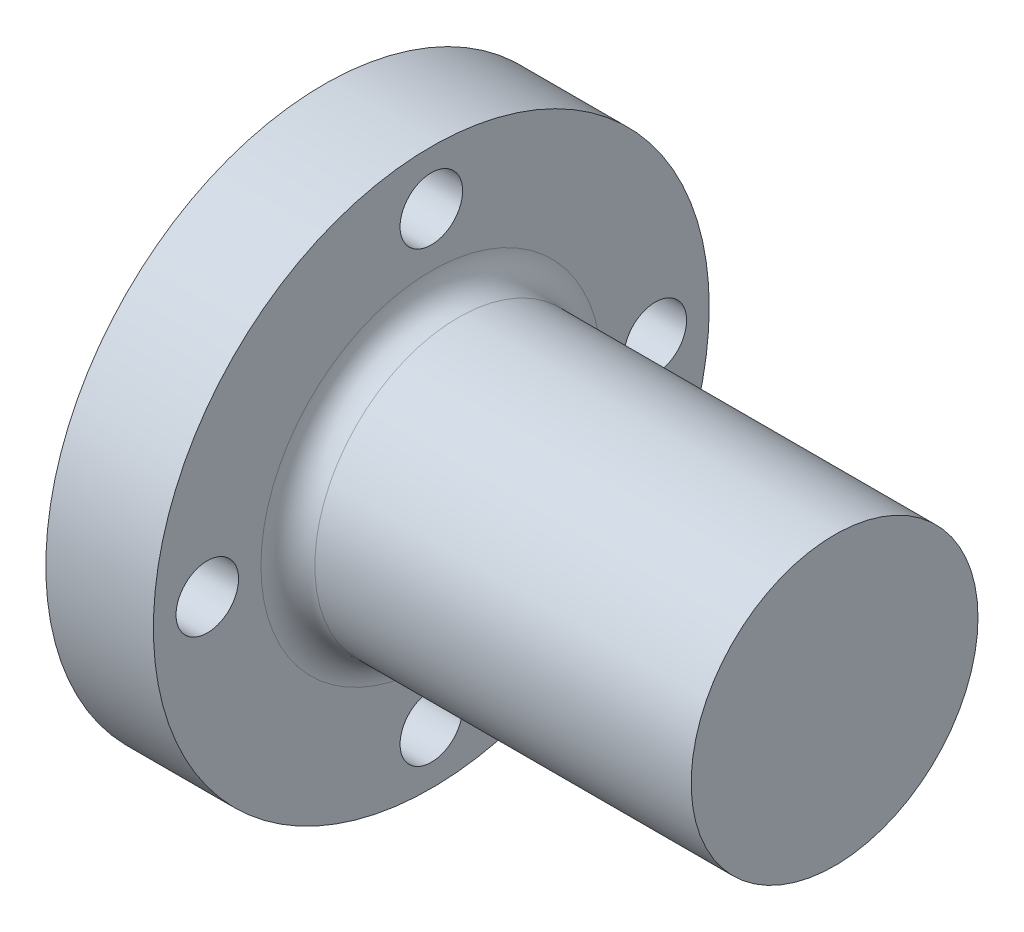
from build123d import *

# Parameters (mm, degrees)
SKETCH1_R           = 24.6126
BOSS_EXTRUDE1_DEPTH = 9.525
BOSS_EXTRUDE2_START = 9.525
SKETCH2_R           = 12.7
BOSS_EXTRUDE2_DEPTH = 35.7124
SKETCH3_R           = 8.7122
BOSS_EXTRUDE4_DEPTH = 4.826
SKETCH4_R           = 2.7686
CUT_EXTRUDE2_DEPTH  = 58.078739617
FILLET1_R           = 0.381
FILLET2_R           = 2.3876


with BuildPart() as part:
    # Sketch1 → Boss-Extrude1 (new body)
    with BuildSketch(Plane.YZ):
        with Locations(Location((0, 0, 0), (0, 0, 270))):
            Circle(SKETCH1_R)
    extrude(amount=BOSS_EXTRUDE1_DEPTH)

    # Sketch2 → Boss-Extrude2 (add)
    with BuildSketch(Plane.YZ.offset(BOSS_EXTRUDE2_START)):
        with Locations(Location((0, 0, 0), (0, 0, 270))):
            Circle(SKETCH2_R)
    extrude(amount=BOSS_EXTRUDE2_DEPTH)

    # Sketch3 → Boss-Extrude4 (add)
    with BuildSketch(Plane.YZ):
        with Locations(Location((0, 0, 0), (0, 0, 270))):
            Circle(SKETCH3_R)
    extrude(amount=-BOSS_EXTRUDE4_DEPTH)

    # Sketch4 → Cut-Extrude2 (cut, through all)
    with BuildSketch(Plane.YZ):
        with Locations(Location((0, 19.8374, 0), (0, 0, 270))):
            Circle(SKETCH4_R)
        with Locations(Location((19.8374, 0, 0), (0, 0, 270))):
            Circle(SKETCH4_R)
        with Locations(Location((0, -19.8374, 0), (0, 0, 270))):
            Circle(SKETCH4_R)
        with Locations(Location((-19.8374, 0, 0), (0, 0, 270))):
            Circle(SKETCH4_R)
    extrude(amount=CUT_EXTRUDE2_DEPTH, mode=Mode.SUBTRACT)

    # Fillet1
    fillet1_edges = [part.edges().sort_by_distance(p)[0] for p in [
        (0, 0, 8.7122),
    ]]
    fillet(fillet1_edges, radius=FILLET1_R)

    # Fillet2
    fillet2_edges = [part.edges().sort_by_distance(p)[0] for p in [
        (9.525, 0, 12.7),
    ]]
    fillet(fillet2_edges, radius=FILLET2_R)


solid = part.part
